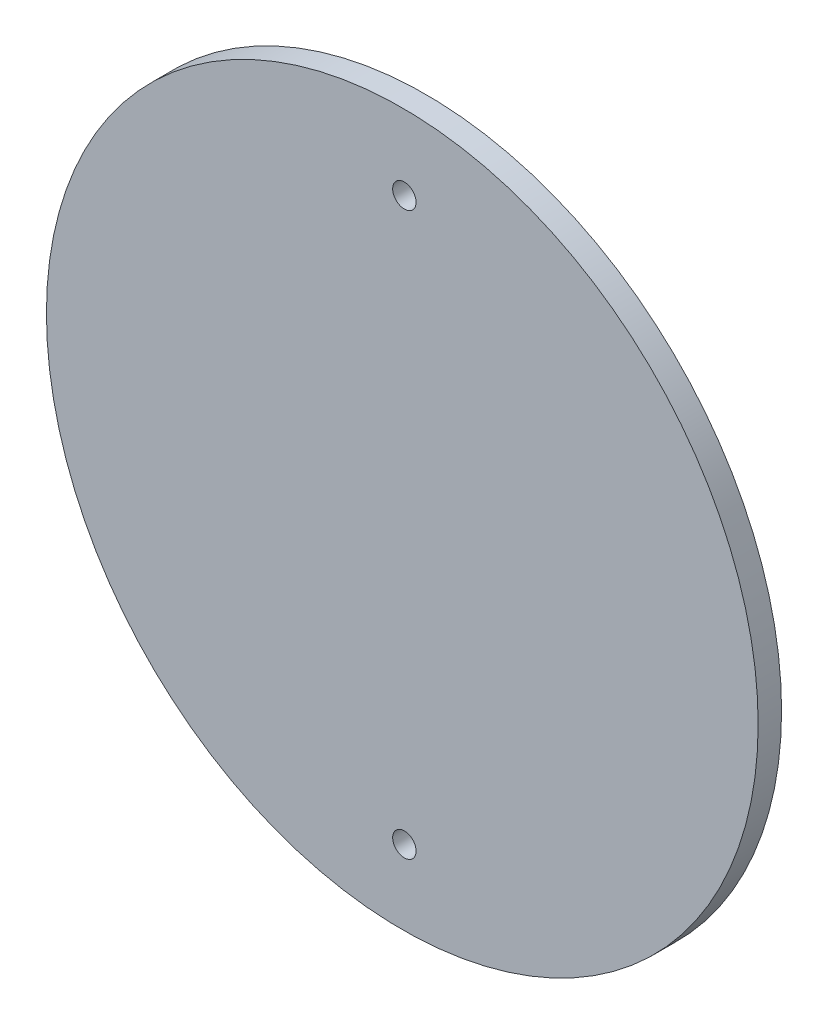
from build123d import *

# Parameters (mm, degrees)
SKETCH1_R           = 76
BOSS_EXTRUDE1_DEPTH = 5
SKETCH2_R           = 2.5
CUT_EXTRUDE1_DEPTH  = 10


with BuildPart() as part:
    # Sketch1 → Boss-Extrude1 (new body)
    with BuildSketch(Plane.XY):
        with Locations((-94.397031795, 74.705010708)):
            Circle(SKETCH1_R)
    extrude(amount=BOSS_EXTRUDE1_DEPTH)

    # Sketch2 → Cut-Extrude1 (cut)
    with BuildSketch(Plane.XY.offset(5)):
        with Locations((-93.953395264, 134.705010708)):
            Circle(SKETCH2_R)
        with Locations((-93.953395264, 14.705010708)):
            Circle(SKETCH2_R)
    extrude(amount=-CUT_EXTRUDE1_DEPTH, mode=Mode.SUBTRACT)


solid = part.part
